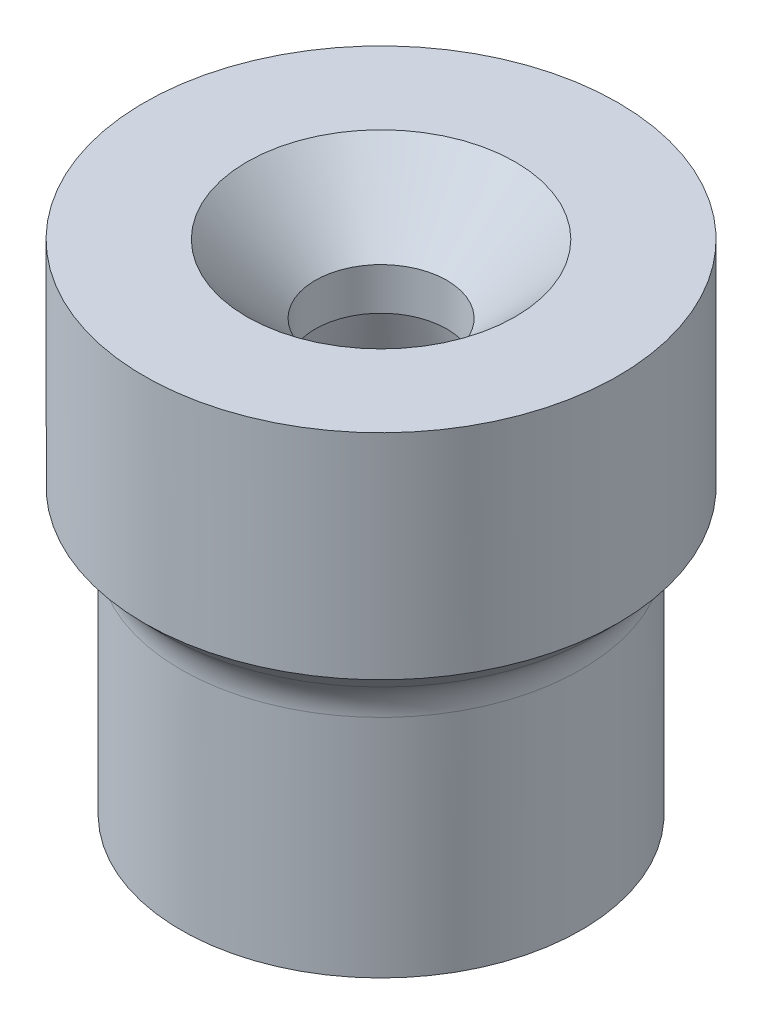
from build123d import *

# Parameters (mm, degrees)
SCHIZZO4_W  = 25
SCHIZZO4_H  = 30
SCHIZZO5_W  = 7
SCHIZZO5_H  = 40.640509339
RACCORDO1_R = 10


with BuildPart() as part:
    # Schizzo1 → Rivoluzione1 (revolve)
    with BuildSketch(Plane.XY, mode=Mode.PRIVATE) as rivoluzione1_sk:
        Polygon((-32.234492396, 0), (-12.5, 73.650128282), (-12.5, 81.650128282), (-25.490381057, 94.640509339), (-63, 94.640509339), (-38, 64.640509339), (-38, 0), align=None)
    revolve(rivoluzione1_sk.sketch.rotate(Axis((0, 0, 0), (0, 1, 0)), 270), axis=Axis((0, 0, 0), (0, 1, 0)))

    # Schizzo4 → Taglia-Rivoluzione3 (revolve, cut)
    with BuildSketch(Plane.XY, mode=Mode.PRIVATE) as taglia_rivoluzione3_sk:
        with Locations((-50.5, 79.640509339)):
            Rectangle(SCHIZZO4_W, SCHIZZO4_H)
    revolve(taglia_rivoluzione3_sk.sketch.rotate(Axis((0, 0, 0), (0, 1, 0)), 270), axis=Axis((0, 0, 0), (0, 1, 0)), mode=Mode.SUBTRACT)

    # Schizzo5 → Rivoluzione2 (revolve)
    with BuildSketch(Plane.XY, mode=Mode.PRIVATE) as rivoluzione2_sk:
        with Locations((-41.5, 74.32025467)):
            Rectangle(SCHIZZO5_W, SCHIZZO5_H)
        Polygon((-38, 54), (-38, 47), (-45, 54), align=None)
    revolve(rivoluzione2_sk.sketch.rotate(Axis((0, 0, 0), (0, 1, 0)), 270), axis=Axis((0, 0, 0), (0, 1, 0)))

    # Raccordo1
    raccordo1_edges = [part.edges().sort_by_distance(p)[0] for p in [
        (0, 47, 38),
    ]]
    fillet(raccordo1_edges, radius=RACCORDO1_R)


solid = part.part
